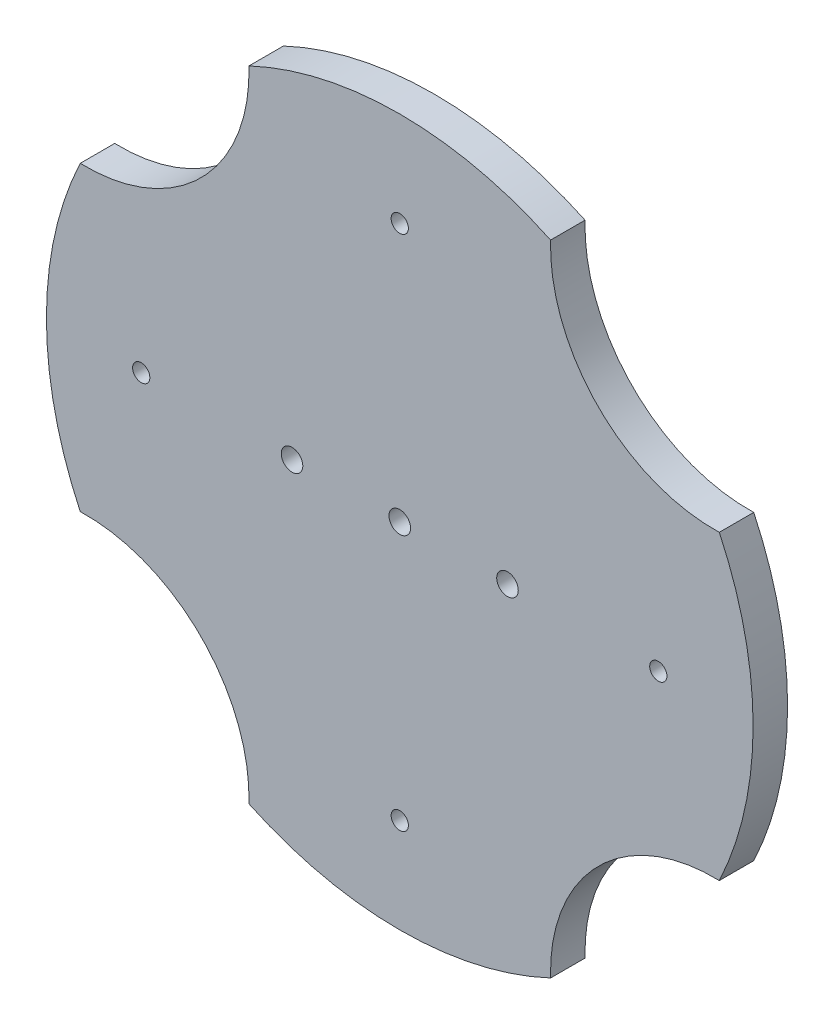
from build123d import *

# Parameters (mm, degrees)
SKETCH1_R           = 82
BOSS_EXTRUDE1_DEPTH = 8
SKETCH2_R           = 2
CUT_EXTRUDE1_DEPTH  = 15
CIRPATTERN2_COUNT   = 4
CUT_EXTRUDE3_DEPTH  = 3.2
CIRPATTERN3_COUNT   = 4
SKETCH10_R          = 2.5
CUT_EXTRUDE4_DEPTH  = 10
CUT_EXTRUDE5_START  = -10
CUT_EXTRUDE5_DEPTH  = 10
CIRPATTERN4_COUNT   = 4


with BuildPart() as part:
    # Sketch1 → Boss-Extrude1 (new body)
    with BuildSketch(Plane.XY):
        Circle(SKETCH1_R)
    extrude(amount=BOSS_EXTRUDE1_DEPTH)

    # Sketch2 → Cut-Extrude1 (cut)
    with BuildSketch(Plane.XY.offset(8)):
        with Locations((0, 60)):
            Circle(SKETCH2_R)
    cut_extrude1 = extrude(amount=-CUT_EXTRUDE1_DEPTH, mode=Mode.SUBTRACT)

    # CirPattern2: Cut-Extrude1 ×4 about axis
    cirpattern2_axis = Axis((0, 0, 0), (0, 0, 1))
    for i in range(1, CIRPATTERN2_COUNT):
        add(cut_extrude1.rotate(cirpattern2_axis, i * 360 / CIRPATTERN2_COUNT), mode=Mode.SUBTRACT)

    # Sketch7 → Cut-Extrude3 (cut)
    with BuildSketch(Plane(origin=(0, 0, 0), x_dir=(-1, 0, 0), z_dir=(0, 0, -1))):
        Polygon((1.788462671, 63.624187441), (-2.244407056, 63.360947827), (-4.032869728, 59.736760386), (-1.788462671, 56.375812559), (2.244407056, 56.639052173), (4.032869728, 60.263239614), align=None)
    cut_extrude3 = extrude(amount=-CUT_EXTRUDE3_DEPTH, mode=Mode.SUBTRACT)

    # CirPattern3: Cut-Extrude3 ×4 about axis
    cirpattern3_axis = Axis((0, 0, 0), (0, 0, 1))
    for i in range(1, CIRPATTERN3_COUNT):
        add(cut_extrude3.rotate(cirpattern3_axis, i * 360 / CIRPATTERN3_COUNT), mode=Mode.SUBTRACT)

    # Sketch10 → Cut-Extrude4 (cut)
    with BuildSketch(Plane.XY.offset(8)):
        Circle(SKETCH10_R)
        with Locations((25, 0)):
            Circle(SKETCH10_R)
        with Locations((-25, 0)):
            Circle(SKETCH10_R)
    extrude(amount=-CUT_EXTRUDE4_DEPTH, mode=Mode.SUBTRACT)

    # Sketch11 → Cut-Extrude5 (cut)
    with BuildSketch(Plane.XY.offset(8).offset(CUT_EXTRUDE5_START)):
        with BuildLine():
            ThreePointArc((-35.000836658, 74.154847672), (-46.112698372, 46.112698372), (-74.154847672, 35.000836658))
            ThreePointArc((-74.154847672, 35.000836658), (-57.982756057, 57.982756057), (-35.000836658, 74.154847672))
        make_face()
    cut_extrude5 = extrude(amount=CUT_EXTRUDE5_DEPTH, mode=Mode.SUBTRACT)

    # CirPattern4: Cut-Extrude5 ×4 about axis
    cirpattern4_axis = Axis((0, 0, 0), (0, 0, 1))
    for i in range(1, CIRPATTERN4_COUNT):
        add(cut_extrude5.rotate(cirpattern4_axis, i * 360 / CIRPATTERN4_COUNT), mode=Mode.SUBTRACT)


solid = part.part
